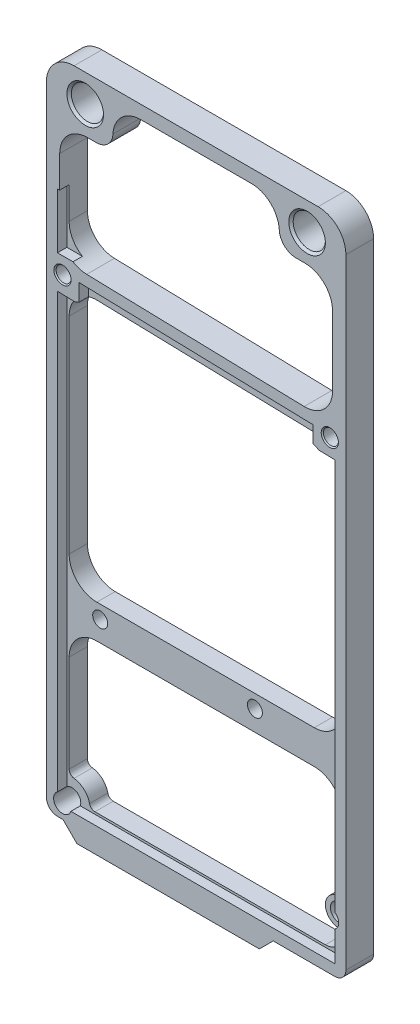
from build123d import *

# Parameters (mm, degrees)
SKETCH1_R           = 2.9
SKETCH1_R_2         = 1.35
SKETCH1_R_3         = 1.6
BOSS_EXTRUDE1_DEPTH = 5
CUT_EXTRUDE1_DEPTH  = 5
CUT_EXTRUDE2_DEPTH  = 5
CHAMFER1_SIZE       = 0.4
CHAMFER2_SIZE       = 0.2
FILLET1_R           = 3
FILLET2_R           = 2
FILLET3_R           = 1
SKETCH4_W           = 20.9
SKETCH4_H           = 6.076557184
CUT_EXTRUDE3_DEPTH  = 1.7
SKETCH5_W           = 8
SKETCH5_H           = 9.98481564
CUT_EXTRUDE5_DEPTH  = 1.7
CUT_EXTRUDE6_DEPTH  = 1.7


with BuildPart() as part:
    # Sketch1 → Boss-Extrude1 (new body)
    with BuildSketch(Plane.XY):
        with BuildLine():
            Line((0, 0), (0, 83.4))
            ThreePointArc((0, 83.4), (1.464466094, 86.935533906), (5, 88.4))
            Line((5, 88.4), (49, 88.4))
            ThreePointArc((49, 88.4), (52.535533906, 86.935533906), (54, 83.4))
            Line((54, 83.4), (54, 0))
            Line((54, 0), (54, -32.8))
            Line((54, -32.8), (0, -32.8))
            Line((0, -32.8), (0, 0))
        make_face()
        with Locations((7, 83.4)):
            Circle(SKETCH1_R, mode=Mode.SUBTRACT)
        with Locations((47, 83.4)):
            Circle(SKETCH1_R, mode=Mode.SUBTRACT)
        with Locations((2.9, 54.7)):
            Circle(SKETCH1_R_2, mode=Mode.SUBTRACT)
        with Locations((51.1, 53.4)):
            Circle(SKETCH1_R_2, mode=Mode.SUBTRACT)
        with Locations((8, 2.6)):
            Circle(SKETCH1_R_2, mode=Mode.SUBTRACT)
        with Locations((35.9, 2.6)):
            Circle(SKETCH1_R_2, mode=Mode.SUBTRACT)
        with Locations((2.9, -27.8)):
            Circle(SKETCH1_R_3, mode=Mode.SUBTRACT)
        with Locations((51.1, -21.6)):
            Circle(SKETCH1_R_3, mode=Mode.SUBTRACT)
    extrude(amount=BOSS_EXTRUDE1_DEPTH)

    # Sketch2 → Cut-Extrude1 (cut)
    with BuildSketch(Plane.XY.offset(5)):
        Polygon((5.5, -32.8), (3, -30.3), (0, -30.3), (0, -32.8), align=None)
        Polygon((38.4, -32.8), (40.9, -30.3), (54, -30.3), (54, -32.8), align=None)
    extrude(amount=-CUT_EXTRUDE1_DEPTH, mode=Mode.SUBTRACT)

    # Sketch3 → Cut-Extrude2 (cut)
    with BuildSketch(Plane.XY.offset(5)):
        with BuildLine():
            Line((12, 81), (12, 78.4))
            Line((12, 78.4), (7.4, 78.4))
            ThreePointArc((7.4, 78.4), (3.864466094, 76.935533906), (2.4, 73.4))
            Line((2.4, 73.4), (2.4, 61.96963128))
            ThreePointArc((2.4, 61.96963128), (3.818077427, 58.48110284), (7.267932273, 56.971375773))
            Line((7.267932273, 56.971375773), (46.467932273, 55.935603416))
            ThreePointArc((46.467932273, 55.935603416), (50.088528441, 57.35193635), (51.6, 60.933858923))
            Line((51.6, 60.933858923), (51.6, 73.4))
            ThreePointArc((51.6, 73.4), (50.135533906, 76.935533906), (46.6, 78.4))
            Line((46.6, 78.4), (42, 78.4))
            Line((42, 78.4), (42, 81))
            ThreePointArc((42, 81), (40.535533906, 84.535533906), (37, 86))
            Line((37, 86), (17, 86))
            ThreePointArc((17, 86), (13.464466094, 84.535533906), (12, 81))
        make_face()
        with BuildLine():
            Line((7.532067727, 52.164396584), (46.732067727, 51.128624227))
            ThreePointArc((46.732067727, 51.128624227), (50.181922573, 49.61889716), (51.6, 46.13036872))
            Line((51.6, 46.13036872), (51.6, 10))
            ThreePointArc((51.6, 10), (50.135533906, 6.464466094), (46.6, 5))
            Line((46.6, 5), (7.4, 5))
            ThreePointArc((7.4, 5), (3.864466094, 6.464466094), (2.4, 10))
            Line((2.4, 10), (2.4, 47.166141077))
            ThreePointArc((2.4, 47.166141077), (3.911471559, 50.74806365), (7.532067727, 52.164396584))
        make_face()
        with BuildLine():
            Line((7.4, -1.076557184), (46.6, -1.076557184))
            ThreePointArc((46.6, -1.076557184), (50.135533906, -2.541023278), (51.6, -6.076557184))
            Line((51.6, -6.076557184), (51.6, -19.150510257))
            ThreePointArc((51.6, -19.150510257), (48.6, -21.6), (51.6, -24.049489743))
            Line((51.6, -24.049489743), (51.6, -24.9))
            ThreePointArc((51.6, -24.9), (50.721320344, -27.021320344), (48.6, -27.9))
            Line((48.6, -27.9), (6.148461174, -27.9))
            ThreePointArc((6.148461174, -27.9), (5.051673794, -25.364266048), (2.4, -24.588691855))
            Line((2.4, -24.588691855), (2.4, -6.076557184))
            ThreePointArc((2.4, -6.076557184), (3.864466094, -2.541023278), (7.4, -1.076557184))
        make_face()
    extrude(amount=-CUT_EXTRUDE2_DEPTH, mode=Mode.SUBTRACT)

    # Chamfer1
    chamfer1_edges = [part.edges().sort_by_distance(p)[0] for p in [
        (4.1, 83.4, 0),
        (4.1, 83.4, 5),
        (44.1, 83.4, 0),
        (44.1, 83.4, 5),
    ]]
    chamfer(chamfer1_edges, length=CHAMFER1_SIZE)

    # Chamfer2
    chamfer2_edges = [part.edges().sort_by_distance(p)[0] for p in [
        (1.55, 54.7, 0),
        (1.55, 54.7, 5),
        (49.75, 53.4, 0),
        (49.75, 53.4, 5),
        (6.65, 2.6, 0),
        (6.65, 2.6, 5),
        (34.55, 2.6, 0),
        (34.55, 2.6, 5),
    ]]
    chamfer(chamfer2_edges, length=CHAMFER2_SIZE)

    # Fillet1
    fillet1_edges = [part.edges().sort_by_distance(p)[0] for p in [
        (42, 78.4, 2.5),
        (12, 78.4, 2.5),
    ]]
    fillet(fillet1_edges, radius=FILLET1_R)

    # Fillet2
    fillet2_edges = [part.edges().sort_by_distance(p)[0] for p in [
        (0, -30.3, 2.5),
        (54, -30.3, 2.5),
    ]]
    fillet(fillet2_edges, radius=FILLET2_R)

    # Fillet3
    fillet3_edges = [part.edges().sort_by_distance(p)[0] for p in [
        (51.6, -24.049489743, 2.5),
        (51.6, -19.150510257, 2.5),
        (6.148461174, -27.9, 2.5),
        (2.4, -24.588691855, 2.5),
    ]]
    fillet(fillet3_edges, radius=FILLET3_R)

    # Sketch4 → Cut-Extrude3 (cut)
    with BuildSketch(Plane.XY.offset(5)):
        with Locations((21.95, 1.961721408)):
            Rectangle(SKETCH4_W, SKETCH4_H)
    extrude(amount=-CUT_EXTRUDE3_DEPTH, mode=Mode.SUBTRACT)

    # Sketch5 → Cut-Extrude5 (cut)
    with BuildSketch(Plane.XY.offset(5)):
        Polygon((2, 51.696310663), (52, 50.375172451), (52, -28.3), (2, -28.3), align=None)
        with Locations((6, 62.69240782)):
            Rectangle(SKETCH5_W, SKETCH5_H)
    extrude(amount=-CUT_EXTRUDE5_DEPTH, mode=Mode.SUBTRACT)

    # Sketch6 → Cut-Extrude6 (cut)
    with BuildSketch(Plane.XY.offset(5)):
        Polygon((48.1, 53.891781634), (5.9, 55.006822285), (5.9, 50.553811317), (48.1, 49.438770667), align=None)
    extrude(amount=-CUT_EXTRUDE6_DEPTH, mode=Mode.SUBTRACT)


solid = part.part
